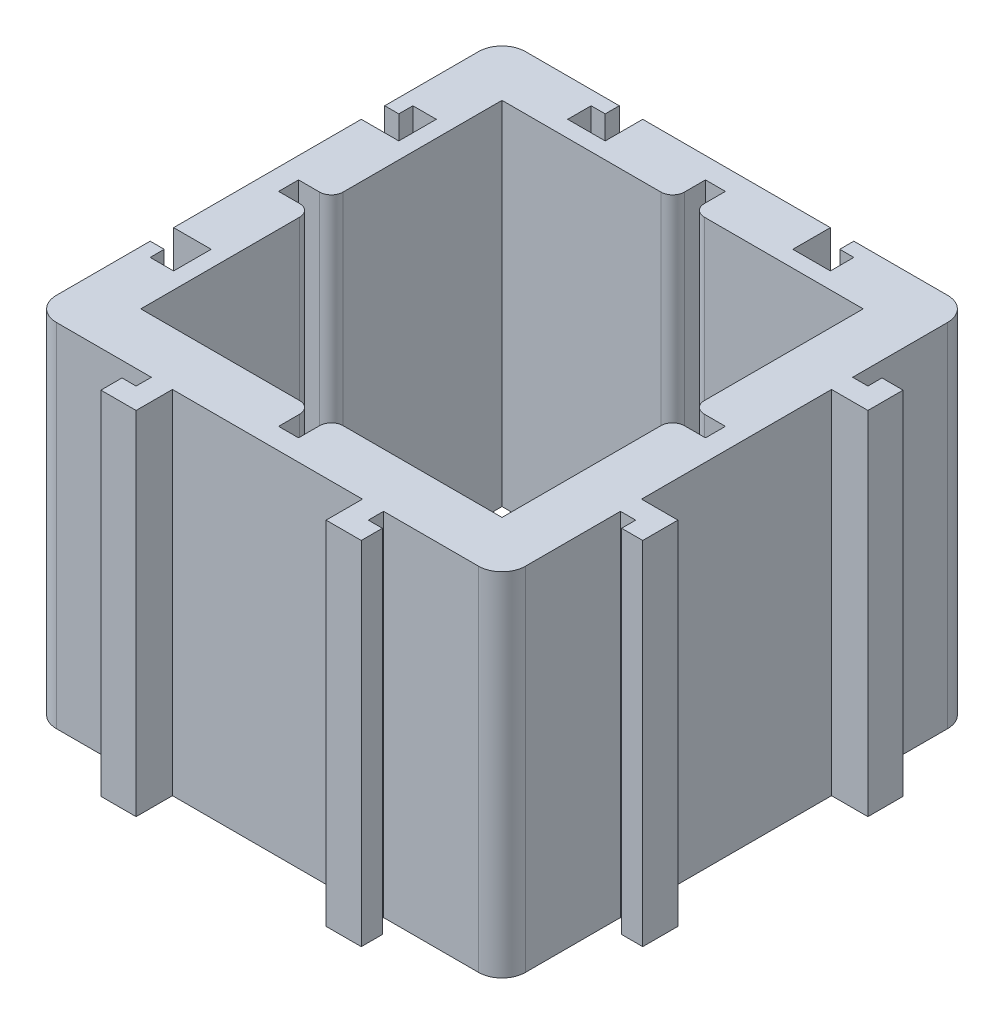
from build123d import *

# Parameters (mm, degrees)
SKETCH1_W           = 50.8
SKETCH1_H           = 50.8
BOSS_EXTRUDE1_DEPTH = 38.1
FILLET1_R           = 2.54
FILLET2_R           = 1.27
SKETCH3_W           = 1.524
SKETCH3_H           = 2.54
SKETCH3_W_2         = 2.54
SKETCH3_H_2         = 1.524
CUT_EXTRUDE1_DEPTH  = 53.363441445
SKETCH5_W           = 2.286
SKETCH5_H           = 2.286
SKETCH5_H_2         = 1.651
SKETCH5_W_2         = 1.524
SKETCH5_H_3         = 1.524
SKETCH5_W_3         = 1.651
BOSS_EXTRUDE2_DEPTH = 38.1


with BuildPart() as part:
    # Sketch1 → Boss-Extrude1 (new body)
    with BuildSketch(Plane(origin=(0, 0, 0), x_dir=(1, 0, 0), z_dir=(0, 1, 0))):
        Rectangle(SKETCH1_W, SKETCH1_H)
        Polygon((-1.0795, -19.558), (-1.0795, -23.114), (1.0795, -23.114), (1.0795, -19.558), (19.558, -19.558), (19.558, -1.0795), (23.114, -1.0795), (23.114, 1.0795), (19.558, 1.0795), (19.558, 19.558), (1.0795, 19.558), (1.0795, 23.114), (-1.0795, 23.114), (-1.0795, 19.558), (-19.558, 19.558), (-19.558, 1.0795), (-23.114, 1.0795), (-23.114, -1.0795), (-19.558, -1.0795), (-19.558, -19.558), align=None, mode=Mode.SUBTRACT)
    extrude(amount=BOSS_EXTRUDE1_DEPTH)

    # Fillet1
    fillet1_edges = [part.edges().sort_by_distance(p)[0] for p in [
        (-25.4, 19.05, -25.4),
        (25.4, 19.05, -25.4),
        (25.4, 19.05, 25.4),
        (-25.4, 19.05, 25.4),
    ]]
    fillet(fillet1_edges, radius=FILLET1_R)

    # Fillet2
    fillet2_edges = [part.edges().sort_by_distance(p)[0] for p in [
        (1.0795, 19.05, 19.558),
        (19.558, 19.05, 1.0795),
        (19.558, 19.05, -1.0795),
        (1.0795, 19.05, -19.558),
        (-1.0795, 19.05, -19.558),
        (-19.558, 19.05, -1.0795),
        (-19.558, 19.05, 1.0795),
        (-1.0795, 19.05, 19.558),
    ]]
    fillet(fillet2_edges, radius=FILLET2_R)

    # Sketch3 → Cut-Extrude1 (cut, through all)
    with BuildSketch(Plane(origin=(0, 38.1, 0), x_dir=(1, 0, 0), z_dir=(0, 1, 0))):
        with Locations((-24.638, 11.43)):
            Rectangle(SKETCH3_W, SKETCH3_H)
        with Locations((-22.606, 11.43)):
            Rectangle(SKETCH3_W_2, SKETCH3_H)
        with Locations((-22.606, 13.462)):
            Rectangle(SKETCH3_W_2, SKETCH3_H_2)
        with Locations((-24.638, -11.43)):
            Rectangle(SKETCH3_W, SKETCH3_H)
        with Locations((-22.606, -11.43)):
            Rectangle(SKETCH3_W_2, SKETCH3_H)
        with Locations((-22.606, -13.462)):
            Rectangle(SKETCH3_W_2, SKETCH3_H_2)
        with Locations((-11.43, 24.638)):
            Rectangle(SKETCH3_W_2, SKETCH3_H_2)
        with Locations((-11.43, 22.606)):
            Rectangle(SKETCH3_W_2, SKETCH3_H)
        with Locations((-13.462, 22.606)):
            Rectangle(SKETCH3_W, SKETCH3_H)
        with Locations((11.43, 24.638)):
            Rectangle(SKETCH3_W_2, SKETCH3_H_2)
        with Locations((11.43, 22.606)):
            Rectangle(SKETCH3_W_2, SKETCH3_H)
        with Locations((13.462, 22.606)):
            Rectangle(SKETCH3_W, SKETCH3_H)
    extrude(amount=-CUT_EXTRUDE1_DEPTH, mode=Mode.SUBTRACT)

    # Sketch5 → Boss-Extrude2 (add)
    with BuildSketch(Plane(origin=(0, 38.1, 0), x_dir=(1, 0, 0), z_dir=(0, 1, 0))):
        with Locations((-11.43, -28.194)):
            Rectangle(SKETCH5_W, SKETCH5_H)
        with Locations((-11.43, -26.2255)):
            Rectangle(SKETCH5_W, SKETCH5_H_2)
        with Locations((-13.335, -28.194)):
            Rectangle(SKETCH5_W_2, SKETCH5_H)
        with Locations((11.43, -28.194)):
            Rectangle(SKETCH5_W, SKETCH5_H)
        with Locations((13.335, -28.194)):
            Rectangle(SKETCH5_W_2, SKETCH5_H)
        with Locations((11.43, -26.2255)):
            Rectangle(SKETCH5_W, SKETCH5_H_2)
        with Locations((28.194, -11.43)):
            Rectangle(SKETCH5_W, SKETCH5_H)
        with Locations((28.194, -13.335)):
            Rectangle(SKETCH5_W, SKETCH5_H_3)
        with Locations((26.2255, -11.43)):
            Rectangle(SKETCH5_W_3, SKETCH5_H)
        with Locations((28.194, 13.335)):
            Rectangle(SKETCH5_W, SKETCH5_H_3)
        with Locations((28.194, 11.43)):
            Rectangle(SKETCH5_W, SKETCH5_H)
        with Locations((26.2255, 11.43)):
            Rectangle(SKETCH5_W_3, SKETCH5_H)
    extrude(amount=-BOSS_EXTRUDE2_DEPTH)


solid = part.part
